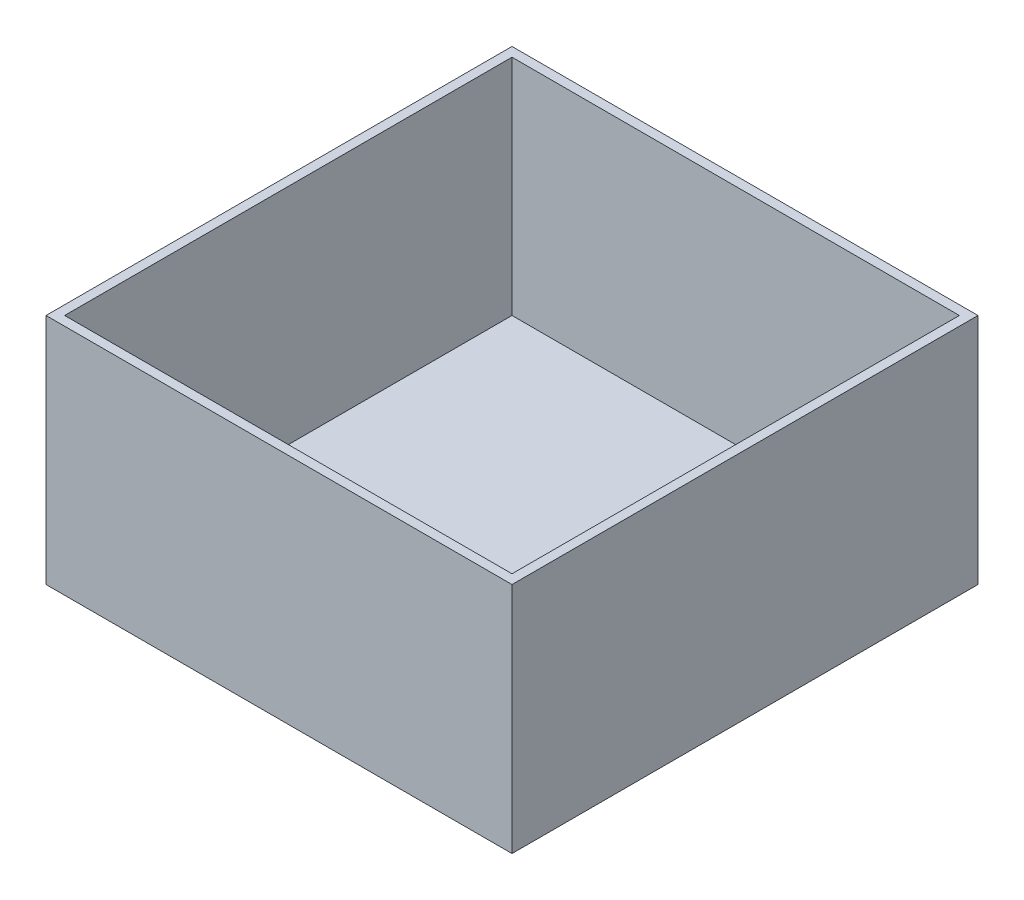
from build123d import *

# Parameters (mm, degrees)
ESQUISSE1_W        = 500
ESQUISSE1_H        = 500
BOSS_EXTRU_1_DEPTH = 250
COQUE1_T           = -10


with BuildPart() as part:
    # Esquisse1 → Boss.-Extru.1 (new body)
    with BuildSketch(Plane(origin=(0, 0, 0), x_dir=(1, 0, 0), z_dir=(0, 1, 0))):
        with Locations((104.080562725, 151.338562297)):
            Rectangle(ESQUISSE1_W, ESQUISSE1_H)
    extrude(amount=BOSS_EXTRU_1_DEPTH)

    # Coque1
    coque1_openings = [part.faces().sort_by_distance(p)[0] for p in [
        (104.080562725, 250, -151.338562297),
    ]]
    offset(amount=COQUE1_T, openings=coque1_openings, kind=Kind.INTERSECTION)


solid = part.part
